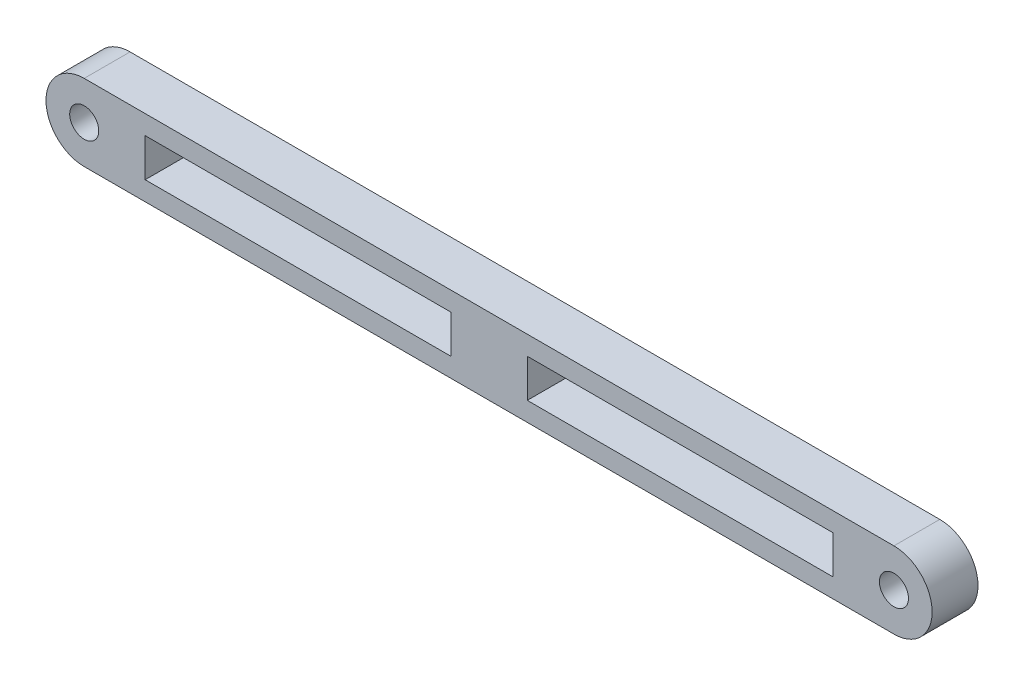
from build123d import *

# Parameters (mm, degrees)
SKETCH1_R           = 1.9
BOSS_EXTRUDE1_DEPTH = 6
SKETCH2_W           = 40
SKETCH2_H           = 5
CUT_EXTRUDE1_DEPTH  = 59.49778203


with BuildPart() as part:
    # Sketch1 → Boss-Extrude1 (new body)
    with BuildSketch(Plane.XY):
        with BuildLine():
            Line((-52.97405025, 5), (52.97405025, 5))
            ThreePointArc((52.97405025, 5), (57.97405025, 0), (52.97405025, -5))
            Line((52.97405025, -5), (-52.97405025, -5))
            ThreePointArc((-52.97405025, -5), (-57.97405025, 0), (-52.97405025, 5))
        make_face()
        with Locations((-52.97405025, 0)):
            Circle(SKETCH1_R, mode=Mode.SUBTRACT)
        with Locations((52.97405025, 0)):
            Circle(SKETCH1_R, mode=Mode.SUBTRACT)
    extrude(amount=BOSS_EXTRUDE1_DEPTH)

    # Sketch2 → Cut-Extrude1 (cut, through all)
    with BuildSketch(Plane.XY.offset(6)):
        with Locations((-25, 0)):
            Rectangle(SKETCH2_W, SKETCH2_H)
        with Locations((25, 0)):
            Rectangle(SKETCH2_W, SKETCH2_H)
    extrude(amount=-CUT_EXTRUDE1_DEPTH, mode=Mode.SUBTRACT)


solid = part.part
